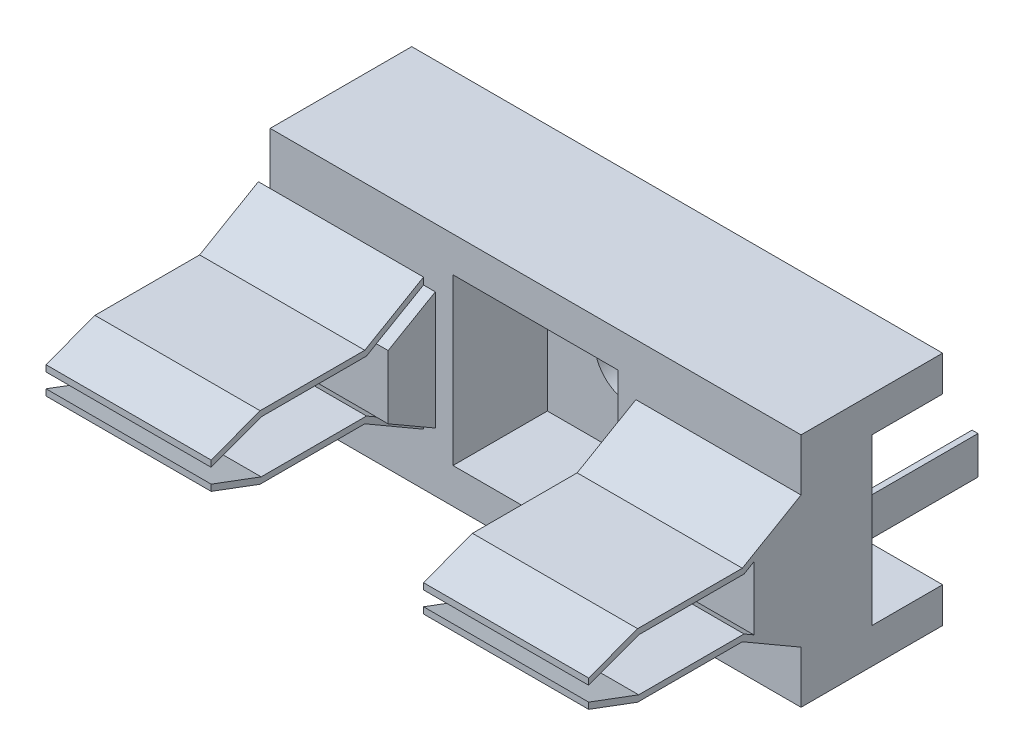
from build123d import *

# Parameters (mm, degrees)
SKETCH_1_W          = 22.5
SKETCH_1_H          = 10
EXTRUDE_1_DEPTH     = 6
SKETCH_2_R          = 1.5
CUT_EXTRUDE_1_DEPTH = 26.342651795
SKETCH_3_W          = 5.75
SKETCH_3_H          = 7
CUT_EXTRUDE_2_DEPTH = 3
CUT_EXTRUDE_3_DEPTH = 4
SKETCH_5_W          = 7
SKETCH_5_H          = 5
EXTRUDE_2_DEPTH     = 2
CUT_EXTRUDE_4_DEPTH = 26.889186932
EXTRUDE_3_DEPTH     = 7
EXTRUDE_4_DEPTH     = 5


with BuildPart() as part:
    # 草图1 → 凸台-拉伸1 (new body)
    with BuildSketch(Plane.XY):
        with Locations((11.25, 5)):
            Rectangle(SKETCH_1_W, SKETCH_1_H)
    extrude(amount=EXTRUDE_1_DEPTH)

    # 草图2 → 切除-拉伸1 (cut, through all)
    with BuildSketch(Plane(origin=(0, 0, 0), x_dir=(-1, 0, 0), z_dir=(0, 0, -1))):
        with Locations((-11.25, 5)):
            Circle(SKETCH_2_R)
    extrude(amount=-CUT_EXTRUDE_1_DEPTH, mode=Mode.SUBTRACT)

    # 草图3 → 切除-拉伸2 (cut)
    with BuildSketch(Plane(origin=(0, 0, 0), x_dir=(-1, 0, 0), z_dir=(0, 0, -1))):
        with Locations((-19.625, 5)):
            Rectangle(SKETCH_3_W, SKETCH_3_H)
        with Locations((-2.875, 5)):
            Rectangle(SKETCH_3_W, SKETCH_3_H)
    extrude(amount=-CUT_EXTRUDE_2_DEPTH, mode=Mode.SUBTRACT)

    # 草图4 → 切除-拉伸3 (cut)
    with BuildSketch(Plane.XY.offset(6)):
        Polygon((14.75, 1.5), (14.75, 8.5), (11.25, 8.5), (7.75, 8.5), (7.75, 1.5), (11.25, 1.5), align=None)
    extrude(amount=-CUT_EXTRUDE_3_DEPTH, mode=Mode.SUBTRACT)

    # 草图5 → 凸台-拉伸2 (add)
    with BuildSketch(Plane.XY.offset(6)):
        with Locations((19, 5)):
            Rectangle(SKETCH_5_W, SKETCH_5_H)
        with Locations((3.5, 5)):
            Rectangle(SKETCH_5_W, SKETCH_5_H)
    extrude(amount=EXTRUDE_2_DEPTH)

    # 草图6 → 切除-拉伸4 (cut, through all)
    with BuildSketch(Plane(origin=(22.5, 0, 0), x_dir=(0, 0, -1), z_dir=(1, 0, 0))):
        Polygon((-6, 7.5), (-8, 6.345299462), (-8, 7.5), align=None)
        Polygon((-8, 3.654700538), (-8, 2.5), (-6, 2.5), align=None)
    extrude(amount=-CUT_EXTRUDE_4_DEPTH, mode=Mode.SUBTRACT)

    # 草图7 → 凸台-拉伸3 (add)
    with BuildSketch(Plane(origin=(22.5, 0, 0), x_dir=(0, 0, -1), z_dir=(1, 0, 0))):
        Polygon((-6, 7.5), (-8.178644615, 6.237293765), (-8.415528154, 6.1), (-12.880891483, 6.1), (-15, 5.308736783), (-15, 5.575596223), (-12.926043311, 6.35), (-8.488722342, 6.35), (-6.157893093, 7.700909921), (-6, 7.792422136), align=None)
        Polygon((-6, 2.5), (-8.178644615, 3.762706235), (-8.415528154, 3.9), (-12.880891483, 3.9), (-15, 4.691263217), (-15, 4.424403777), (-12.926043311, 3.65), (-8.488722342, 3.65), (-6.157893093, 2.299090079), (-6, 2.207577864), align=None)
    extrude_3 = extrude(amount=-EXTRUDE_3_DEPTH)

    # 镜向1: 凸台-拉伸3 across plane
    add(extrude_3.mirror(Plane(origin=(11, 0, 0), x_dir=(0, 0, 1), z_dir=(1, 0, 0))))

    # 草图8 → 凸台-拉伸4 (add)
    with BuildSketch(Plane(origin=(0, 0, 3), x_dir=(-1, 0, 0), z_dir=(0, 0, -1))):
        Polygon((-0.25, 5.8), (-0.25, 5), (0, 5), (0, 5.007441817), (0, 5.8), align=None)
        Polygon((0, 5), (-0.25, 5), (-0.25, 4.2), (0, 4.2), (0, 4.992558183), align=None)
    extrude_4 = extrude(amount=EXTRUDE_4_DEPTH)

    # 镜向2: 凸台-拉伸4 across plane
    add(extrude_4.mirror(Plane(origin=(11, 0, 0), x_dir=(0, 0, 1), z_dir=(1, 0, 0))))


solid = part.part
